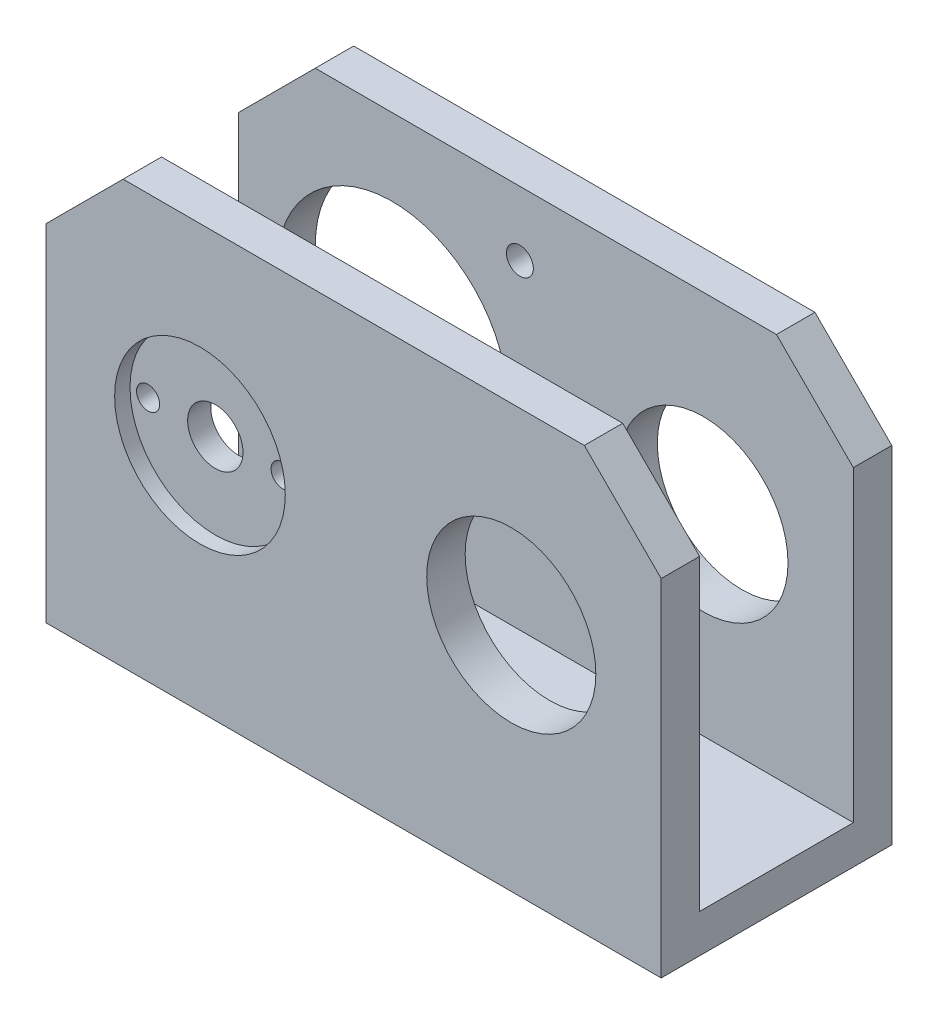
from build123d import *

# Parameters (mm, degrees)
SKETCH1_W           = 80
SKETCH1_H           = 50
BOSS_EXTRUDE1_DEPTH = 5
SKETCH2_R           = 3.6
CUT_EXTRUDE1_DEPTH  = 123.886126149
SKETCH3_R           = 1.5
CUT_EXTRUDE2_DEPTH  = 123.886126149
SKETCH4_R           = 11.1
CUT_EXTRUDE3_DEPTH  = 2
SKETCH5_R           = 11
CUT_EXTRUDE4_DEPTH  = 123.886126149
SKETCH7_W           = 80
SKETCH7_H           = 30
BOSS_EXTRUDE2_DEPTH = 5
SKETCH13_W          = 80
SKETCH13_H          = 5
BOSS_EXTRUDE3_DEPTH = 50
CUT_EXTRUDE6_REACH  = 129.519
SKETCH14_R          = 15
CUT_EXTRUDE7_REACH  = 129.519
SKETCH16_R          = 1.75
CHAMFER1_SIZE       = 10


with BuildPart() as part:
    # Sketch1 → Boss-Extrude1 (new body)
    with BuildSketch(Plane.XY):
        with Locations((-80, -1)):
            Rectangle(SKETCH1_W, SKETCH1_H)
    extrude(amount=BOSS_EXTRUDE1_DEPTH)

    # Sketch2 → Cut-Extrude1 (cut, through all)
    with BuildSketch(Plane.XY.offset(5)):
        with Locations((-100, -1)):
            Circle(SKETCH2_R)
    extrude(amount=-CUT_EXTRUDE1_DEPTH, mode=Mode.SUBTRACT)

    # Sketch3 → Cut-Extrude2 (cut, through all)
    with BuildSketch(Plane.XY.offset(5)):
        with Locations((-91.25, -1)):
            Circle(SKETCH3_R)
        with Locations((-108.75, -1)):
            Circle(SKETCH3_R)
    extrude(amount=-CUT_EXTRUDE2_DEPTH, mode=Mode.SUBTRACT)

    # Sketch4 → Cut-Extrude3 (cut)
    with BuildSketch(Plane.XY.offset(5)):
        with Locations((-100, -1)):
            Circle(SKETCH4_R)
    extrude(amount=-CUT_EXTRUDE3_DEPTH, mode=Mode.SUBTRACT)

    # Sketch5 → Cut-Extrude4 (cut, through all)
    with BuildSketch(Plane.XY.offset(5)):
        with Locations((-59.5, -1)):
            Circle(SKETCH5_R)
    cut_extrude4 = extrude(amount=-CUT_EXTRUDE4_DEPTH, mode=Mode.SUBTRACT)

    # Sketch7 → Boss-Extrude2 (add)
    with BuildSketch(Plane.XZ.offset(26)):
        with Locations((-80, -10)):
            Rectangle(SKETCH7_W, SKETCH7_H)
    extrude(amount=BOSS_EXTRUDE2_DEPTH)

    # Sketch13 → Boss-Extrude3 (add)
    with BuildSketch(Plane(origin=(0, -26, 0), x_dir=(1, 0, 0), z_dir=(0, 1, 0))):
        with Locations((-80, 22.5)):
            Rectangle(SKETCH13_W, SKETCH13_H)
    extrude(amount=BOSS_EXTRUDE3_DEPTH)

    # Sketch14 → Cut-Extrude6 (cut, up to next)
    with BuildSketch(Plane(origin=(0, 0, -25), x_dir=(-1, 0, 0), z_dir=(0, 0, -1)), mode=Mode.PRIVATE) as cut_extrude6_sk1:
        with Locations((100, -1)):
            Circle(SKETCH14_R)
    cut_extrude6_tool1 = extrude(cut_extrude6_sk1.sketch, amount=-CUT_EXTRUDE6_REACH, mode=Mode.PRIVATE) & part.part
    add(cut_extrude6_tool1.solids().sort_by_distance((-100, -1, -25))[0], mode=Mode.SUBTRACT)

    # Sketch16 → Cut-Extrude7 (cut, up to next)
    with BuildSketch(Plane(origin=(0, 0, -25), x_dir=(-1, 0, 0), z_dir=(0, 0, -1)), mode=Mode.PRIVATE) as cut_extrude7_sk1:
        with Locations((83.382990642, 15.617009358)):
            Circle(SKETCH16_R)
    cut_extrude7_tool1 = extrude(cut_extrude7_sk1.sketch, amount=-CUT_EXTRUDE7_REACH, mode=Mode.PRIVATE) & part.part
    # Sketch16 → Cut-Extrude7 (cut, up to next)
    with BuildSketch(Plane(origin=(0, 0, -25), x_dir=(-1, 0, 0), z_dir=(0, 0, -1)), mode=Mode.PRIVATE) as cut_extrude7_sk2:
        with Locations((116.617009358, -17.617009358)):
            Circle(SKETCH16_R)
    cut_extrude7_tool2 = extrude(cut_extrude7_sk2.sketch, amount=-CUT_EXTRUDE7_REACH, mode=Mode.PRIVATE) & part.part
    add(cut_extrude7_tool1.solids().sort_by_distance((-83.382991, 15.617009, -25))[0], mode=Mode.SUBTRACT)
    add(cut_extrude7_tool2.solids().sort_by_distance((-116.617009, -17.617009, -25))[0], mode=Mode.SUBTRACT)

    # Mirror6: Cut-Extrude4 across plane
    add(cut_extrude4.mirror(Plane(origin=(0, 0, -10), x_dir=(1, 0, 0), z_dir=(0, 0, -1))), mode=Mode.SUBTRACT)

    # Chamfer1
    chamfer1_edges = [part.edges().sort_by_distance(p)[0] for p in [
        (-40, 24, -22.5),
        (-120, 24, -22.5),
        (-120, 24, 2.5),
        (-40, 24, 2.5),
    ]]
    chamfer(chamfer1_edges, length=CHAMFER1_SIZE)


solid = part.part
